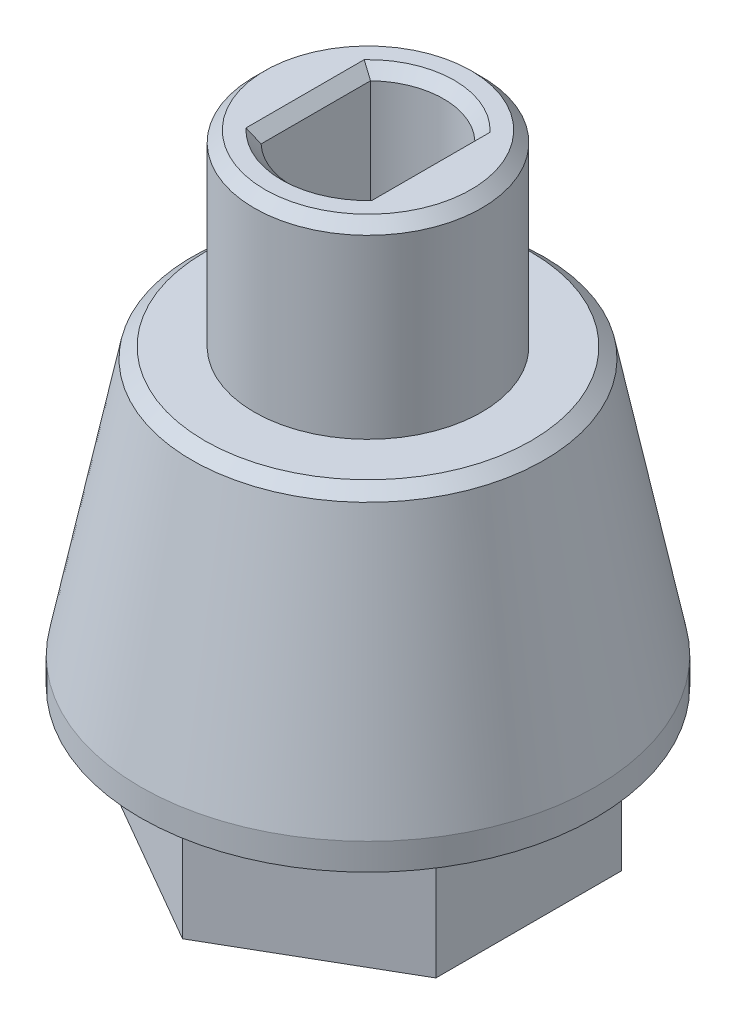
from build123d import *

# Parameters (mm, degrees)
BOSS_EXTRUDE1_DEPTH = 4.7
SKETCH2_R           = 8.5
BOSS_EXTRUDE2_DEPTH = 1
SKETCH4_R           = 6.5
SKETCH3_R           = 8.5
SKETCH5_R           = 4.25
BOSS_EXTRUDE3_DEPTH = 7
CHAMFER1_SIZE       = 0.4
SKETCH6_R           = 0.75
CUT_EXTRUDE1_DEPTH  = 7
CUT_EXTRUDE2_START  = -1
CUT_EXTRUDE2_DEPTH  = 1


with BuildPart() as part:
    # Sketch1 → Boss-Extrude1 (new body)
    with BuildSketch(Plane(origin=(0, 0, 0), x_dir=(1, 0, 0), z_dir=(0, 1, 0))):
        Polygon((0, 6.92820323), (6, 3.464101615), (6, -3.464101615), (0, -6.92820323), (-6, -3.464101615), (-6, 3.464101615), align=None)
    extrude(amount=BOSS_EXTRUDE1_DEPTH)

    # Sketch2 → Boss-Extrude2 (add)
    with BuildSketch(Plane(origin=(0, 4.7, 0), x_dir=(1, 0, 0), z_dir=(0, 1, 0))):
        with Locations(Location((0, 0, 0), (0, 0, 270))):
            Circle(SKETCH2_R)
    extrude(amount=BOSS_EXTRUDE2_DEPTH)

    # Sketch4 → Loft1 section 0
    with BuildSketch(Plane(origin=(0, 15.7, 0), x_dir=(1, 0, 0), z_dir=(0, 1, 0))):
        Circle(SKETCH4_R)
    # Sketch3 → Loft1 section 1
    with BuildSketch(Plane(origin=(0, 5.7, 0), x_dir=(1, 0, 0), z_dir=(0, 1, 0))):
        Circle(SKETCH3_R)
    loft()

    # Sketch5 → Boss-Extrude3 (add)
    with BuildSketch(Plane(origin=(0, 15.7, 0), x_dir=(1, 0, 0), z_dir=(0, 1, 0))):
        with Locations(Location((0, 0, 0), (0, 0, 270))):
            Circle(SKETCH5_R)
        with BuildLine():
            Line((-1.95, 2.044046232), (-1.95, -2.044046232))
            ThreePointArc((-1.95, -2.044046232), (0, -2.825), (1.95, -2.044046232))
            Line((1.95, -2.044046232), (1.95, 2.044046232))
            ThreePointArc((1.95, 2.044046232), (0, 2.825), (-1.95, 2.044046232))
        make_face(mode=Mode.SUBTRACT)
    extrude(amount=BOSS_EXTRUDE3_DEPTH)

    # Chamfer1
    chamfer1_edges = [part.edges().sort_by_distance(p)[0] for p in [
        (-6.5, 15.7, 0),
        (0, 22.7, -4.25),
        (0, 22.7, -2.825),
        (-1.95, 22.7, 0),
        (0, 22.7, 2.825),
        (1.95, 22.7, 0),
    ]]
    chamfer(chamfer1_edges, length=CHAMFER1_SIZE)

    # Sketch6 → Cut-Extrude1 (cut)
    with BuildSketch(Plane.XZ):
        with Locations(Location((0, 0, 0), (0, 0, 270))):
            Circle(SKETCH6_R)
    extrude(amount=-CUT_EXTRUDE1_DEPTH, mode=Mode.SUBTRACT)

    # Sketch7 → Cut-Extrude2 (cut)
    with BuildSketch(Plane(origin=(0, 15.7, 0), x_dir=(1, 0, 0), z_dir=(0, 1, 0)).offset(CUT_EXTRUDE2_START)):
        with BuildLine():
            Line((1.95, -2.044046232), (1.95, 2.044046232))
            ThreePointArc((1.95, 2.044046232), (0, 2.825), (-1.95, 2.044046232))
            Line((-1.95, 2.044046232), (-1.95, -2.044046232))
            ThreePointArc((-1.95, -2.044046232), (0, -2.825), (1.95, -2.044046232))
        make_face()
    extrude(amount=CUT_EXTRUDE2_DEPTH, mode=Mode.SUBTRACT)


solid = part.part
